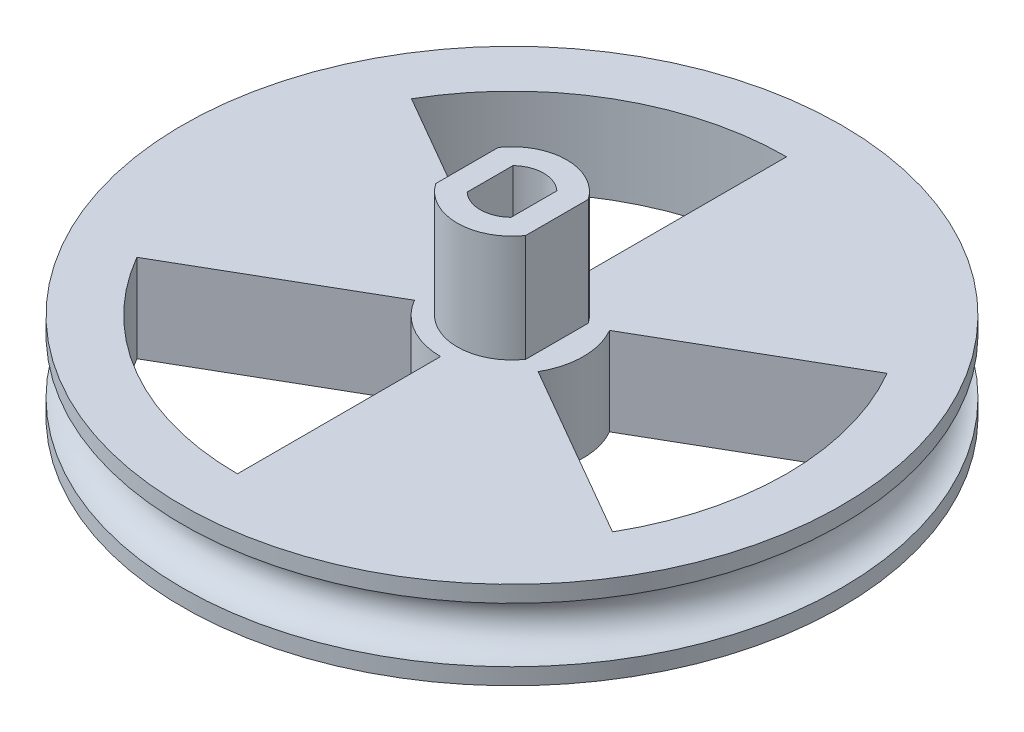
from build123d import *

# Parameters (mm, degrees)
EXTRUS_O1_DEPTH = 9.3
EXTRUS_O2_DEPTH = 7.3
ESCALA3_SCALE   = 1.05
ESBO_O3_R       = 30
EXTRUS_O3_DEPTH = 8
ESBO_O4_R       = 2.5
EXTRUS_O6_DEPTH = 8


with BuildPart() as part:
    # Esboço1 → Extrusão1 (new body)
    with BuildSketch(Plane(origin=(0, 0, 0), x_dir=(1, 0, 0), z_dir=(0, 1, 0))):
        with BuildLine():
            Line((3.9, 0), (0, 0))
            Line((0, 0), (-3.9, 0))
            Line((-3.9, 0), (-3.9, -2.711549373))
            ThreePointArc((-3.9, -2.711549373), (0, -4.75), (3.9, -2.711549373))
            Line((3.9, -2.711549373), (3.9, 0))
        make_face()
        with BuildLine():
            Line((-3.9, 0), (0, 0))
            Line((0, 0), (3.9, 0))
            Line((3.9, 0), (3.9, 2.711549373))
            ThreePointArc((3.9, 2.711549373), (0, 4.75), (-3.9, 2.711549373))
            Line((-3.9, 2.711549373), (-3.9, 0))
        make_face()
        with BuildLine():
            Line((-3.9, 0), (0, 0))
            Line((0, 0), (3.9, 0))
            Line((3.9, 0), (3.9, 2.711549373))
            ThreePointArc((3.9, 2.711549373), (0, 4.75), (-3.9, 2.711549373))
            Line((-3.9, 2.711549373), (-3.9, 0))
        make_face()
    extrude(amount=EXTRUS_O1_DEPTH)

    # Esboço2 → Extrusão2 (cut)
    with BuildSketch(Plane(origin=(0, 9.3, 0), x_dir=(1, 0, 0), z_dir=(0, 1, 0))):
        with BuildLine():
            Line((-1.9, 0), (0, 0))
            Line((0, 0), (1.9, 0))
            Line((1.9, 0), (1.9, 1.988089535))
            ThreePointArc((1.9, 1.988089535), (0, 2.75), (-1.9, 1.988089535))
            Line((-1.9, 1.988089535), (-1.9, 0))
        make_face()
        with BuildLine():
            Line((1.9, 0), (0, 0))
            Line((0, 0), (-1.9, 0))
            Line((-1.9, 0), (-1.9, -1.988089535))
            ThreePointArc((-1.9, -1.988089535), (0, -2.75), (1.9, -1.988089535))
            Line((1.9, -1.988089535), (1.9, 0))
        make_face()
    extrude(amount=-EXTRUS_O2_DEPTH, mode=Mode.SUBTRACT)


with BuildPart() as part_1:
    # Escala3: scaled about (0, 0, 0)
    add(part.part.scale(ESCALA3_SCALE))

    # Esboço3 → Extrusão3 (add)
    with BuildSketch(Plane.XZ):
        with Locations(Location((0, 0, 0), (0, 0, 270))):
            Circle(ESBO_O3_R)
    extrude(amount=EXTRUS_O3_DEPTH)

    # Varredura de corte1: sweep along a path in Esboço6
    with BuildLine(Plane(origin=(0, -4, 0), x_dir=(-1, 0, 0), z_dir=(0, 1, 0))) as varredura_de_corte1_path:
        CenterArc((0, 0), 30, 0, 360)
    # Esboço4 → Varredura de corte1 (sweep, cut)
    with BuildSketch(Plane(origin=(0, 0, 0), x_dir=(0, 0, -1), z_dir=(1, 0, 0))):
        with Locations((-30, -4)):
            Circle(ESBO_O4_R)
    sweep(path=varredura_de_corte1_path.line, mode=Mode.SUBTRACT)

    # Esboço7 → Extrusão6 (cut)
    with BuildSketch(Plane.XZ.offset(8)):
        with BuildLine():
            Line((-21.650635095, 12.5), (-5.629165125, 3.25))
            ThreePointArc((-5.629165125, 3.25), (-3.25, 5.629165125), (0, 6.5))
            Line((0, 6.5), (0, 25))
            ThreePointArc((0, 25), (-12.5, 21.650635095), (-21.650635095, 12.5))
        make_face()
        with BuildLine():
            Line((0, -25), (0, -6.5))
            ThreePointArc((0, -6.5), (-3.25, -5.629165125), (-5.629165125, -3.25))
            Line((-5.629165125, -3.25), (-21.650635095, -12.5))
            ThreePointArc((-21.650635095, -12.5), (-12.5, -21.650635095), (0, -25))
        make_face()
        with BuildLine():
            Line((21.650635095, 12.5), (5.629165125, 3.25))
            ThreePointArc((5.629165125, 3.25), (6.5, 0), (5.629165125, -3.25))
            Line((5.629165125, -3.25), (21.650635095, -12.5))
            ThreePointArc((21.650635095, -12.5), (25, 0), (21.650635095, 12.5))
        make_face()
    extrude(amount=-EXTRUS_O6_DEPTH, mode=Mode.SUBTRACT)


solid = part_1.part
